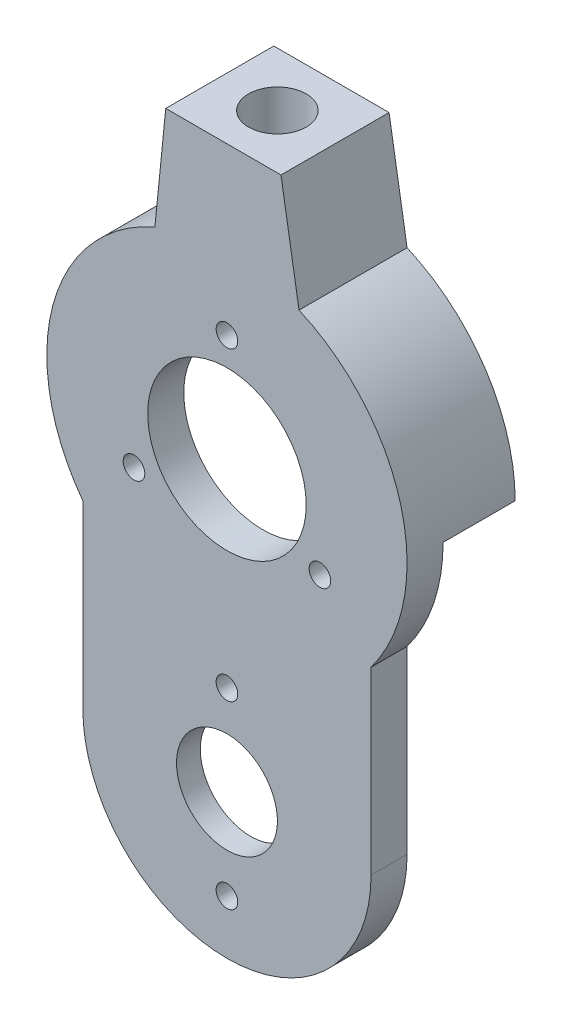
from build123d import *

# Parameters (mm, degrees)
SKETCH1_W           = 40
SKETCH1_H           = 80
BOSS_EXTRUDE1_DEPTH = 5
SKETCH2_R           = 11
CUT_EXTRUDE1_DEPTH  = 5
SKETCH3_R           = 1.5
CUT_EXTRUDE2_DEPTH  = 5
SKETCH4_R           = 1.5
CUT_EXTRUDE3_DEPTH  = 5
SKETCH6_R           = 19
CUT_EXTRUDE4_DEPTH  = 1.7
SKETCH7_R           = 7
CUT_EXTRUDE5_DEPTH  = 45.842948164
CUT_EXTRUDE6_DEPTH  = 46
BOSS_EXTRUDE2_DEPTH = 5
BOSS_EXTRUDE3_START = 10
BOSS_EXTRUDE3_DEPTH = 10
BOSS_EXTRUDE4_DEPTH = 15
SKETCH12_R          = 3
CUT_EXTRUDE7_DEPTH  = 15
SKETCH13_R          = 4
CUT_EXTRUDE8_DEPTH  = 15


with BuildPart() as part:
    # Sketch1 → Boss-Extrude1 (new body)
    with BuildSketch(Plane.XY):
        Rectangle(SKETCH1_W, SKETCH1_H)
    extrude(amount=BOSS_EXTRUDE1_DEPTH)

    # Sketch2 → Cut-Extrude1 (cut)
    with BuildSketch(Plane.XY.offset(5)):
        with Locations((0, 20)):
            Circle(SKETCH2_R)
    extrude(amount=-CUT_EXTRUDE1_DEPTH, mode=Mode.SUBTRACT)

    # Sketch3 → Cut-Extrude2 (cut)
    with BuildSketch(Plane(origin=(0, 0, 0), x_dir=(-1, 0, 0), z_dir=(0, 0, -1))):
        with Locations((0, 34.9)):
            Circle(SKETCH3_R)
        with Locations((12.903778516, 12.55)):
            Circle(SKETCH3_R)
        with Locations((-12.903778516, 12.55)):
            Circle(SKETCH3_R)
    extrude(amount=-CUT_EXTRUDE2_DEPTH, mode=Mode.SUBTRACT)

    # Sketch4 → Cut-Extrude3 (cut)
    with BuildSketch(Plane(origin=(0, 0, 0), x_dir=(-1, 0, 0), z_dir=(0, 0, -1))):
        with Locations((0, -7.5)):
            Circle(SKETCH4_R)
        with Locations((0, -32.5)):
            Circle(SKETCH4_R)
    extrude(amount=-CUT_EXTRUDE3_DEPTH, mode=Mode.SUBTRACT)

    # Sketch6 → Cut-Extrude4 (cut)
    with BuildSketch(Plane(origin=(0, 0, 0), x_dir=(-1, 0, 0), z_dir=(0, 0, -1))):
        with Locations((0, -20)):
            Circle(SKETCH6_R)
    extrude(amount=-CUT_EXTRUDE4_DEPTH, mode=Mode.SUBTRACT)

    # Sketch7 → Cut-Extrude5 (cut, through all)
    with BuildSketch(Plane(origin=(0, 0, 1.7), x_dir=(-1, 0, 0), z_dir=(0, 0, -1))):
        with Locations((0, -20)):
            Circle(SKETCH7_R)
    extrude(amount=-CUT_EXTRUDE5_DEPTH, mode=Mode.SUBTRACT)

    # Sketch8 → Cut-Extrude6 (cut, through all)
    with BuildSketch(Plane(origin=(0, 0, 0), x_dir=(-1, 0, 0), z_dir=(0, 0, -1))):
        with BuildLine():
            Line((-20, 40), (-20, 20))
            ThreePointArc((-20, 20), (-14.142135605, 34.142135642), (5.2e-08, 40))
            Line((5.2e-08, 40), (-20, 40))
        make_face()
        with BuildLine():
            Line((20, 40), (5.2e-08, 40))
            ThreePointArc((5.2e-08, 40), (14.142135642, 34.142135605), (20, 20))
            Line((20, 20), (20, 40))
        make_face()
        with BuildLine():
            ThreePointArc((-6e-09, -40), (-14.142135626, -34.142135622), (-20, -20))
            Line((-20, -20), (-20, -40))
            Line((-20, -40), (-6e-09, -40))
        make_face()
        with BuildLine():
            ThreePointArc((20, -20), (14.142135622, -34.142135626), (-6e-09, -40))
            Line((-6e-09, -40), (20, -40))
            Line((20, -40), (20, -20))
        make_face()
    extrude(amount=-CUT_EXTRUDE6_DEPTH, mode=Mode.SUBTRACT)

    # Sketch9 → Boss-Extrude2 (add)
    with BuildSketch(Plane(origin=(0, 0, 0), x_dir=(-1, 0, 0), z_dir=(0, 0, -1))):
        with BuildLine():
            Line((20, 20), (20, 5))
            ThreePointArc((20, 5), (0, 45), (-20, 5))
            Line((-20, 5), (-20, 20))
            ThreePointArc((-20, 20), (0, 40), (20, 20))
        make_face()
    extrude(amount=-BOSS_EXTRUDE2_DEPTH)

    # Sketch10 → Boss-Extrude3 (add)
    with BuildSketch(Plane(origin=(0, 0, 0), x_dir=(-1, 0, 0), z_dir=(0, 0, -1)).offset(BOSS_EXTRUDE3_START)):
        with BuildLine():
            Line((20, 20), (25, 20))
            ThreePointArc((25, 20), (0, 45), (-25, 20))
            Line((-25, 20), (-20, 20))
            ThreePointArc((-20, 20), (0, 40), (20, 20))
        make_face()
    extrude(amount=-BOSS_EXTRUDE3_DEPTH)

    # Sketch11 → Boss-Extrude4 (add)
    with BuildSketch(Plane(origin=(0, 0, -10), x_dir=(-1, 0, 0), z_dir=(0, 0, -1))):
        Polygon((-10, 42.912878475), (-7.5, 57.912878475), (8.5, 57.912878475), (10, 42.912878475), align=None)
    extrude(amount=-BOSS_EXTRUDE4_DEPTH)

    # Sketch12 → Cut-Extrude7 (cut)
    with BuildSketch(Plane(origin=(0, 57.912878475, 0), x_dir=(1, 0, 0), z_dir=(0, 1, 0))):
        with Locations(Location((-0.5, 2.5, 0), (0, 0, 270))):
            Circle(SKETCH12_R)
    extrude(amount=-CUT_EXTRUDE7_DEPTH, mode=Mode.SUBTRACT)

    # Sketch13 → Cut-Extrude8 (cut)
    with BuildSketch(Plane(origin=(0, 57.912878475, 0), x_dir=(1, 0, 0), z_dir=(0, 1, 0))):
        with Locations(Location((-0.5, 2.5, 0), (0, 0, 270))):
            Circle(SKETCH13_R)
    extrude(amount=-CUT_EXTRUDE8_DEPTH, mode=Mode.SUBTRACT)


solid = part.part
